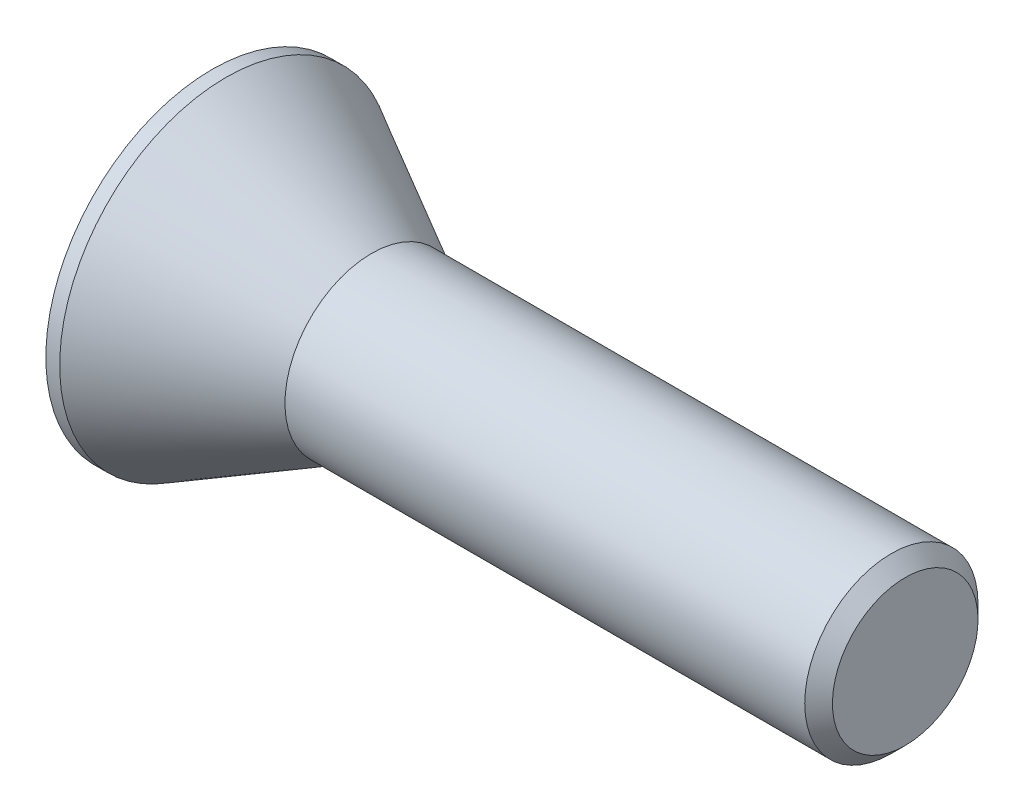
from build123d import *

# Parameters (mm, degrees)
CUT_EXTRUDE_1_DEPTH = 0.4
CHAMFER_1_SIZE      = 0.2


with BuildPart() as part:
    # 草图1 → 旋转1 (revolve)
    with BuildSketch(Plane.XY, mode=Mode.PRIVATE) as revolve_1_sk:
        Polygon((0, 0), (0, -2.4), (0.2, -2.4), (2.3, -1.25), (10, -1.25), (10, 0), align=None)
    revolve(revolve_1_sk.sketch.rotate(Axis((10, 0, 0), (-1, 0, 0)), 180), axis=Axis((10, 0, 0), (-1, 0, 0)))

    # 草图2 → 切除-拉伸1 (cut)
    with BuildSketch(Plane.ZY):
        Polygon((0.866025404, 0), (0.433012702, 0.75), (-0.433012702, 0.75), (-0.866025404, 0), (-0.433012702, -0.75), (0.433012702, -0.75), align=None)
    extrude(amount=-CUT_EXTRUDE_1_DEPTH, mode=Mode.SUBTRACT)

    # 倒角1
    chamfer_1_edges = [part.edges().sort_by_distance(p)[0] for p in [
        (10, -1.25, 0),
    ]]
    chamfer(chamfer_1_edges, length=CHAMFER_1_SIZE)


solid = part.part
